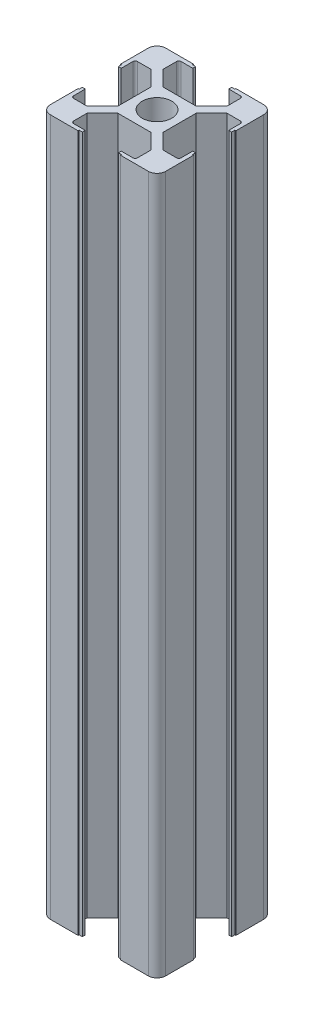
from build123d import *

# Parameters (mm, degrees)
SKETCH_1_W                  = 19.873537876
SKETCH_1_H                  = 120
EXTRUDE_1_DEPTH             = 19.873537875
CUT_EXTRUDE_1_DEPTH         = 121.820026295
CUT_EXTRUDE_2_DEPTH         = 120
CUT_EXTRUDE_3_DEPTH         = 121.820026295
CUT_EXTRUDE_4_DEPTH         = 121.820026295
HOLE_WIZARD_5_0_5_1_D       = 5
HOLE_WIZARD_5_0_5_2_D       = 5
HOLE_WIZARD_5_0_5_3_D       = 5
HOLE_WIZARD_5_0_5_4_D       = 5
HOLE_WIZARD_5_0_5_4_DEPTH   = 11.7
HOLE_WIZARD_5_0_5_5_D       = 5
HOLE_WIZARD_5_0_5_5_DEPTH   = 11.7
HOLE_WIZARD_5_0_5_6_D       = 5
HOLE_WIZARD_5_0_5_6_DEPTH   = 11.7
HOLE_WIZARD_5_1_5_1_1_D     = 5.1
HOLE_WIZARD_5_1_5_1_1_DEPTH = 226.268310074
FILLET_1_R                  = 0.4
FILLET_2_R                  = 1.5


with BuildPart() as part:
    # 草图1 → 凸台-拉伸1 (new body)
    with BuildSketch(Plane.XY.offset(9.936768938)):
        with Locations((0, 60)):
            Rectangle(SKETCH_1_W, SKETCH_1_H)
    extrude(amount=-EXTRUDE_1_DEPTH)

    # 草图2 → 切除-拉伸1 (cut, through all)
    with BuildSketch(Plane(origin=(0, 120, 0), x_dir=(-1, 0, 0), z_dir=(0, 1, 0))):
        Polygon((-3.65, -9.936768938), (3.65, -9.936768938), (3.65, -9.76), (3.1, -9.76), (3.1, -9.26), (5.5, -9.26), (5.5, -6.56), (2.84, -3.9), (-2.84, -3.9), (-5.5, -6.56), (-5.5, -9.26), (-3.1, -9.26), (-3.1, -9.76), (-3.65, -9.76), align=None)
    extrude(amount=-CUT_EXTRUDE_1_DEPTH, mode=Mode.SUBTRACT)

    # 草图3 → 切除-拉伸2 (cut)
    with BuildSketch(Plane(origin=(0, 120, 0), x_dir=(-1, 0, 0), z_dir=(0, 1, 0))):
        Polygon((-9.936768938, 3.65), (-9.936768938, -3.65), (-9.76, -3.65), (-9.76, -3.1), (-9.26, -3.1), (-9.26, -5.5), (-6.56, -5.5), (-3.9, -2.84), (-3.9, 2.84), (-6.56, 5.5), (-9.26, 5.5), (-9.26, 3.1), (-9.76, 3.1), (-9.76, 3.65), align=None)
    extrude(amount=-CUT_EXTRUDE_2_DEPTH, mode=Mode.SUBTRACT)

    # 草图4 → 切除-拉伸3 (cut, through all)
    with BuildSketch(Plane(origin=(0, 120, 0), x_dir=(-1, 0, 0), z_dir=(0, 1, 0))):
        Polygon((3.65, 9.936768938), (-3.65, 9.936768938), (-3.65, 9.76), (-3.1, 9.76), (-3.1, 9.26), (-5.5, 9.26), (-5.5, 6.56), (-2.84, 3.9), (2.84, 3.9), (5.5, 6.56), (5.5, 9.26), (3.1, 9.26), (3.1, 9.76), (3.65, 9.76), align=None)
    extrude(amount=-CUT_EXTRUDE_3_DEPTH, mode=Mode.SUBTRACT)

    # 草图5 → 切除-拉伸4 (cut, through all)
    with BuildSketch(Plane(origin=(0, 120, 0), x_dir=(-1, 0, 0), z_dir=(0, 1, 0))):
        Polygon((9.936768938, -3.65), (9.936768938, 3.65), (9.76, 3.65), (9.76, 3.1), (9.26, 3.1), (9.26, 5.5), (6.56, 5.5), (3.9, 2.84), (3.9, -2.84), (6.56, -5.5), (9.26, -5.5), (9.26, -3.1), (9.76, -3.1), (9.76, -3.65), align=None)
    extrude(amount=-CUT_EXTRUDE_4_DEPTH, mode=Mode.SUBTRACT)

    # Ø5.0 (5) 直径孔1 (through all)
    with Locations(Plane.ZY.offset(3.9)):
        with Locations((0, 12)):
            Hole(HOLE_WIZARD_5_0_5_1_D / 2)

    # Ø5.0 (5) 直径孔2 (through all)
    with Locations(Plane(origin=(3.9, 0, 0), x_dir=(0, 0, -1), z_dir=(1, 0, 0))):
        with Locations((0, 68)):
            Hole(HOLE_WIZARD_5_0_5_2_D / 2)

    # Ø5.0 (5) 直径孔3 (through all)
    with Locations(Plane(origin=(0, 0, -3.9), x_dir=(-1, 0, 0), z_dir=(0, 0, -1))):
        with Locations((0, 108)):
            Hole(HOLE_WIZARD_5_0_5_3_D / 2)

    # Ø5.0 (5) 直径孔4
    with Locations(Plane(origin=(0, 0, -3.9), x_dir=(-1, 0, 0), z_dir=(0, 0, -1))):
        with Locations((0, 68)):
            Hole(HOLE_WIZARD_5_0_5_4_D / 2, depth=HOLE_WIZARD_5_0_5_4_DEPTH)

    # Ø5.0 (5) 直径孔5
    with Locations(Plane.ZY.offset(3.9)):
        with Locations((0, 108)):
            Hole(HOLE_WIZARD_5_0_5_5_D / 2, depth=HOLE_WIZARD_5_0_5_5_DEPTH)

    # Ø5.0 (5) 直径孔6
    with Locations(Plane.XY.offset(3.9)):
        with Locations((0, 12)):
            Hole(HOLE_WIZARD_5_0_5_6_D / 2, depth=HOLE_WIZARD_5_0_5_6_DEPTH)

    # Ø5.1 (5.1) 直径孔1
    with Locations(Plane(origin=(0, 120, 0), x_dir=(1, 0, 0), z_dir=(0, 1, 0))):
        with Locations((0, 0)):
            Hole(HOLE_WIZARD_5_1_5_1_1_D / 2, depth=HOLE_WIZARD_5_1_5_1_1_DEPTH)

    # 圆角1
    fillet_1_edges = [part.edges().sort_by_distance(p)[0] for p in [
        (-5.5, 60, 9.26),
        (5.5, 60, 9.26),
        (-9.26, 60, -5.5),
        (-9.26, 60, 5.5),
        (5.5, 60, -9.26),
        (-5.5, 60, -9.26),
        (9.26, 60, 5.5),
        (9.26, 60, -5.5),
    ]]
    fillet(fillet_1_edges, radius=FILLET_1_R)

    # 圆角2
    fillet_2_edges = [part.edges().sort_by_distance(p)[0] for p in [
        (9.936768938, 60, -9.936768938),
        (9.936768938, 60, 9.936768938),
        (-9.936768938, 60, 9.936768938),
        (-9.936768938, 60, -9.936768938),
    ]]
    fillet(fillet_2_edges, radius=FILLET_2_R)


solid = part.part
